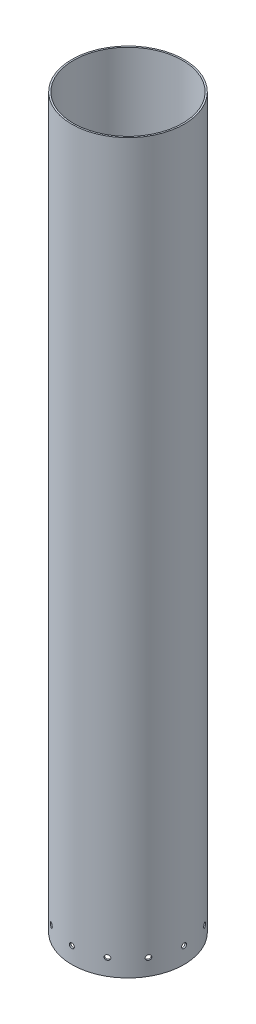
from build123d import *

# Parameters (mm, degrees)
SKETCH1_R               = 78.359
SKETCH1_R_2             = 76.2
BOSS_EXTRUDE1_DEPTH     = 1016
CUT_EXTRUDE1_REACH      = 1032.998
CUT_EXTRUDE1_END_RADIUS = 76.2
SKETCH2_R               = 3.429
CIRPATTERN1_COUNT       = 12


with BuildPart() as part:
    # Sketch1 → Boss-Extrude1 (new body)
    with BuildSketch(Plane(origin=(0, 0, 0), x_dir=(1, 0, 0), z_dir=(0, 1, 0))):
        with Locations(Location((0, 0, 0), (0, 0, 270))):
            Circle(SKETCH1_R)
        with Locations(Location((0, 0, 0), (0, 0, 270))):
            Circle(SKETCH1_R_2, mode=Mode.SUBTRACT)
    extrude(amount=BOSS_EXTRUDE1_DEPTH)

    # Cut-Extrude1: up to this cylinder (the profile starts outside it)
    cut_extrude1_end = Plane(origin=(0, 22.86, 0), z_dir=(0, -1, 0)) * Cylinder(CUT_EXTRUDE1_END_RADIUS, 2219.396, mode=Mode.PRIVATE)
    # Sketch2 → Cut-Extrude1 (cut, up to the surface)
    with BuildSketch(Plane.XY.offset(78.359), mode=Mode.PRIVATE) as cut_extrude1_sk1:
        with Locations((0, 22.86)):
            Circle(SKETCH2_R)
    cut_extrude1_tool1 = extrude(cut_extrude1_sk1.sketch, amount=-CUT_EXTRUDE1_REACH, mode=Mode.PRIVATE) - cut_extrude1_end
    cut_extrude1 = cut_extrude1_tool1.solids().sort_by_distance((0, 22.86, 78.359))[0]
    add(cut_extrude1, mode=Mode.SUBTRACT)

    # CirPattern1: Cut-Extrude1 ×12 about axis
    cirpattern1_axis = Axis((0, 0, 0), (0, 1, 0))
    for i in range(1, CIRPATTERN1_COUNT):
        add(cut_extrude1.rotate(cirpattern1_axis, i * 360 / CIRPATTERN1_COUNT), mode=Mode.SUBTRACT)


solid = part.part
